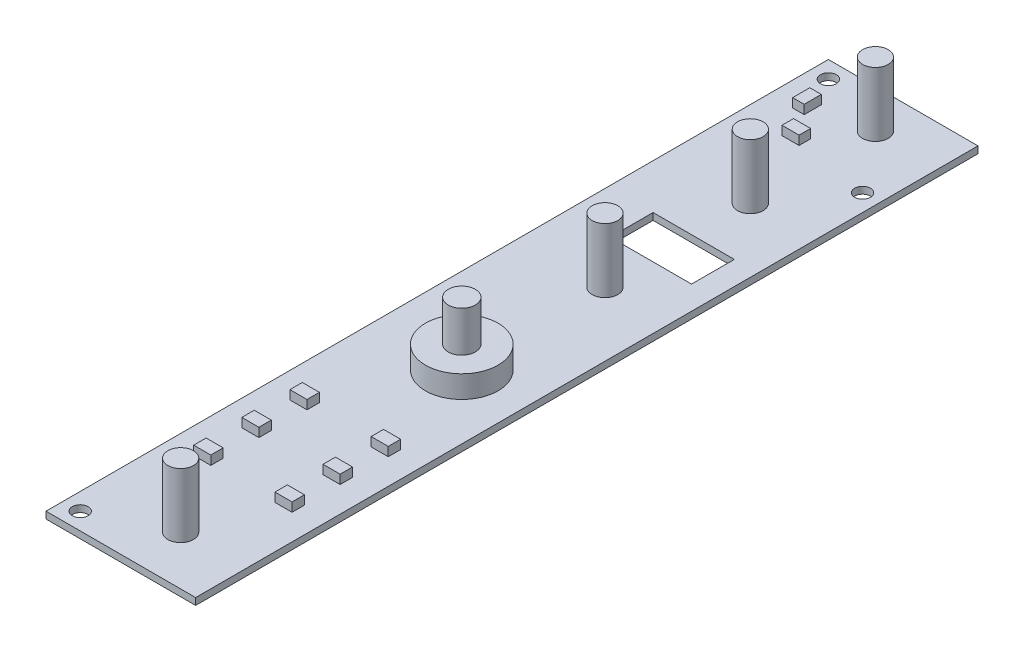
from build123d import *

# Parameters (mm, degrees)
PCB_W               = 35
PCB_H               = 183
BOSS_EXTRUDE1_DEPTH = 1.6
SKETCH3_R           = 3
BOSS_EXTRUDE2_DEPTH = 15
SKETCH4_R           = 8.5
BOSS_EXTRUDE3_DEPTH = 5.21
SKETCH5_R           = 3.175
BOSS_EXTRUDE4_DEPTH = 9.52
SKETCH6_W           = 4
SKETCH6_H           = 2.9
BOSS_EXTRUDE5_DEPTH = 2.1
SKETCH7_R           = 1.85
CUT_EXTRUDE2_DEPTH  = 95.35835946
SKETCH8_W           = 4
SKETCH8_H           = 2.7
SKETCH8_W_2         = 2.7
SKETCH8_H_2         = 4
BOSS_EXTRUDE6_DEPTH = 2.1
SKETCH9_W           = 19
SKETCH9_H           = 10
CUT_EXTRUDE3_DEPTH  = 95.35835946


with BuildPart() as part:
    # pcb → Boss-Extrude1 (new body)
    with BuildSketch(Plane(origin=(0, 0, 0), x_dir=(1, 0, 0), z_dir=(0, 1, 0))):
        Rectangle(PCB_W, PCB_H)
    extrude(amount=BOSS_EXTRUDE1_DEPTH)

    # Sketch3 → Boss-Extrude2 (add)
    with BuildSketch(Plane(origin=(0, 1.6, 0), x_dir=(1, 0, 0), z_dir=(0, 1, 0))):
        with Locations(Location((2.5, 82.5, 0), (0, 0, 270))):
            Circle(SKETCH3_R)
        with Locations(Location((2.5, 53.25, 0), (0, 0, 270))):
            Circle(SKETCH3_R)
        with Locations(Location((2.5, 19.25, 0), (0, 0, 270))):
            Circle(SKETCH3_R)
        with Locations(Location((2.5, -80, 0), (0, 0, 270))):
            Circle(SKETCH3_R)
    extrude(amount=BOSS_EXTRUDE2_DEPTH)

    # Sketch4 → Boss-Extrude3 (add)
    with BuildSketch(Plane(origin=(0, 1.6, 0), x_dir=(1, 0, 0), z_dir=(0, 1, 0))):
        with Locations(Location((2.5, -14.25, 0), (0, 0, 270))):
            Circle(SKETCH4_R)
    extrude(amount=BOSS_EXTRUDE3_DEPTH)

    # Sketch5 → Boss-Extrude4 (add)
    with BuildSketch(Plane(origin=(0, 6.81, 0), x_dir=(1, 0, 0), z_dir=(0, 1, 0))):
        with Locations(Location((2.5, -14.25, 0), (0, 0, 270))):
            Circle(SKETCH5_R)
    extrude(amount=BOSS_EXTRUDE4_DEPTH)

    # Sketch6 → Boss-Extrude5 (add)
    with BuildSketch(Plane(origin=(0, 1.6, 0), x_dir=(1, 0, 0), z_dir=(0, 1, 0))):
        with Locations((-9.5, -39)):
            Rectangle(SKETCH6_W, SKETCH6_H)
        with Locations((9.5, -39)):
            Rectangle(SKETCH6_W, SKETCH6_H)
        with Locations((-9.5, -50.25)):
            Rectangle(SKETCH6_W, SKETCH6_H)
        with Locations((9.5, -50.25)):
            Rectangle(SKETCH6_W, SKETCH6_H)
        with Locations((-9.5, -61.5)):
            Rectangle(SKETCH6_W, SKETCH6_H)
        with Locations((9.5, -61.5)):
            Rectangle(SKETCH6_W, SKETCH6_H)
    extrude(amount=BOSS_EXTRUDE5_DEPTH)

    # Sketch7 → Cut-Extrude2 (cut, through all)
    with BuildSketch(Plane(origin=(0, 1.6, 0), x_dir=(1, 0, 0), z_dir=(0, 1, 0))):
        with Locations(Location((13.5, 68.5, 0), (0, 0, 270))):
            Circle(SKETCH7_R)
        with Locations(Location((-13.5, 87.5, 0), (0, 0, 270))):
            Circle(SKETCH7_R)
        with Locations(Location((-13.5, -87.5, 0), (0, 0, 270))):
            Circle(SKETCH7_R)
    extrude(amount=-CUT_EXTRUDE2_DEPTH, mode=Mode.SUBTRACT)

    # Sketch8 → Boss-Extrude6 (add)
    with BuildSketch(Plane(origin=(0, 1.6, 0), x_dir=(1, 0, 0), z_dir=(0, 1, 0))):
        with Locations((-5.5, 72)):
            Rectangle(SKETCH8_W, SKETCH8_H)
        with Locations((-10.5, 79.5)):
            Rectangle(SKETCH8_W_2, SKETCH8_H_2)
    extrude(amount=BOSS_EXTRUDE6_DEPTH)

    # Sketch9 → Cut-Extrude3 (cut, through all)
    with BuildSketch(Plane(origin=(0, 1.6, 0), x_dir=(1, 0, 0), z_dir=(0, 1, 0))):
        with Locations((2.5, 35)):
            Rectangle(SKETCH9_W, SKETCH9_H)
    extrude(amount=-CUT_EXTRUDE3_DEPTH, mode=Mode.SUBTRACT)


solid = part.part
